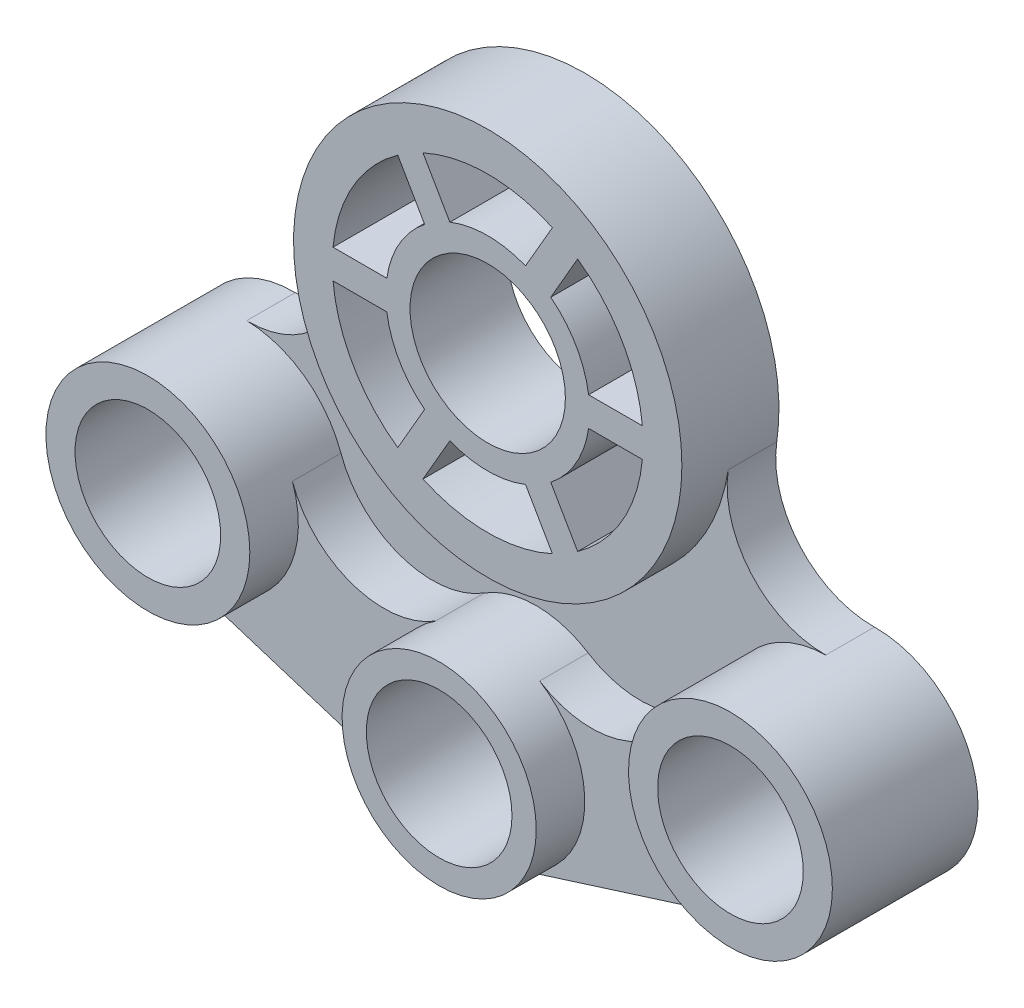
from build123d import *

# Parameters (mm, degrees)
BOSS_EXTRUDE1_DEPTH   = 20
BOSS_EXTRUDE1_2_DEPTH = 20
SKETCH3_R             = 40
SKETCH3_R_2           = 16
BOSS_EXTRUDE1_3_DEPTH = 20
BOSS_EXTRUDE2_DEPTH   = 10
SKETCH3_4_R           = 21
SKETCH3_4_R_2         = 15
SKETCH3_4_R_3         = 20
BOSS_EXTRUDE3_DEPTH   = 30


with BuildPart() as part:
    # Sketch3 → Boss-Extrude1 (new body)
    with BuildSketch(Plane.XY):
        with BuildLine():
            Line((6.023764702, -89.071294105), (66.324952937, -70.02485881))
            ThreePointArc((66.324952937, -70.02485881), (44.876208292, -64.569520389), (40.22513893, -42.932124106))
            ThreePointArc((40.22513893, -42.932124106), (27.903629702, -55.111072059), (10.695968955, -53.100406866))
            ThreePointArc((10.695968955, -53.100406866), (19.833394958, -72.576129737), (6.023764702, -89.071294105))
        make_face()
    extrude(amount=BOSS_EXTRUDE1_DEPTH)



with BuildPart() as body_2:
    # Sketch3 → Boss-Extrude1 2 (new body)
    with BuildSketch(Plane.XY):
        with BuildLine():
            Line((-66.324952937, -70.02485881), (-6.023764702, -89.071294105))
            ThreePointArc((-6.023764702, -89.071294105), (-19.833394958, -72.576129737), (-10.695968955, -53.100406866))
            ThreePointArc((-10.695968955, -53.100406866), (-27.903629702, -55.111072059), (-40.22513893, -42.932124106))
            ThreePointArc((-40.22513893, -42.932124106), (-44.876208292, -64.569520389), (-66.324952937, -70.02485881))
        make_face()
    extrude(amount=BOSS_EXTRUDE1_2_DEPTH)


with BuildPart() as body_3:
    # Sketch3 → Boss-Extrude1 3 (new body)
    with BuildSketch(Plane.XY):
        Circle(SKETCH3_R)
        with BuildLine():
            ThreePointArc((-7.794228634, -19.5), (0, -21), (7.794228634, -19.5))
            Line((7.794228634, -19.5), (13.331456111, -29.090759323))
            ThreePointArc((13.331456111, -29.090759323), (0, -32), (-13.331456111, -29.090759323))
            Line((-13.331456111, -29.090759323), (-7.794228634, -19.5))
        make_face(mode=Mode.SUBTRACT)
        with BuildLine():
            ThreePointArc((-20.784609691, -3), (-18.186533479, -10.5), (-12.990381057, -16.5))
            Line((-12.990381057, -16.5), (-18.527608533, -26.090759323))
            ThreePointArc((-18.527608533, -26.090759323), (-27.712812921, -16), (-31.859064644, -3))
            Line((-31.859064644, -3), (-20.784609691, -3))
        make_face(mode=Mode.SUBTRACT)
        with BuildLine():
            ThreePointArc((-12.990381057, 16.5), (-18.186533479, 10.5), (-20.784609691, 3))
            Line((-20.784609691, 3), (-31.859064644, 3))
            ThreePointArc((-31.859064644, 3), (-27.712812921, 16), (-18.527608533, 26.090759323))
            Line((-18.527608533, 26.090759323), (-12.990381057, 16.5))
        make_face(mode=Mode.SUBTRACT)
        with BuildLine():
            ThreePointArc((7.794228634, 19.5), (0, 21), (-7.794228634, 19.5))
            Line((-7.794228634, 19.5), (-13.331456111, 29.090759323))
            ThreePointArc((-13.331456111, 29.090759323), (0, 32), (13.331456111, 29.090759323))
            Line((13.331456111, 29.090759323), (7.794228634, 19.5))
        make_face(mode=Mode.SUBTRACT)
        with BuildLine():
            ThreePointArc((12.990381057, -16.5), (18.186533479, -10.5), (20.784609691, -3))
            Line((20.784609691, -3), (31.859064644, -3))
            ThreePointArc((31.859064644, -3), (27.712812921, -16), (18.527608533, -26.090759323))
            Line((18.527608533, -26.090759323), (12.990381057, -16.5))
        make_face(mode=Mode.SUBTRACT)
        Circle(SKETCH3_R_2, mode=Mode.SUBTRACT)
        with BuildLine():
            Line((31.859064644, 3), (20.784609691, 3))
            ThreePointArc((20.784609691, 3), (18.186533479, 10.5), (12.990381057, 16.5))
            Line((12.990381057, 16.5), (18.527608533, 26.090759323))
            ThreePointArc((18.527608533, 26.090759323), (27.712812921, 16), (31.859064644, 3))
        make_face(mode=Mode.SUBTRACT)
    extrude(amount=BOSS_EXTRUDE1_3_DEPTH)


with BuildPart() as part_1:
    add(part.part)

    add(body_2.part)  # Boss-Extrude2 merges body 2

    add(body_3.part)  # Boss-Extrude2 merges body 3
    # Sketch3<3> → Boss-Extrude2 (add)
    with BuildSketch(Plane.XY):
        with BuildLine():
            ThreePointArc((10.695968955, -53.100406866), (27.903629702, -55.111072059), (40.22513893, -42.932124106))
            ThreePointArc((40.22513893, -42.932124106), (47.76318349, -32.933649432), (59.651863383, -29.002885891))
            ThreePointArc((59.651863383, -29.002885891), (44.262528341, -22.168588856), (39.546869801, -6.003756239))
            ThreePointArc((39.546869801, -6.003756239), (0, -40), (-39.546869801, -6.003756239))
            ThreePointArc((-39.546869801, -6.003756239), (-44.262528341, -22.168588856), (-59.651863383, -29.002885891))
            ThreePointArc((-59.651863383, -29.002885891), (-47.76318349, -32.933649432), (-40.22513893, -42.932124106))
            ThreePointArc((-40.22513893, -42.932124106), (-27.903629702, -55.111072059), (-10.695968955, -53.100406866))
            ThreePointArc((-10.695968955, -53.100406866), (0, -50), (10.695968955, -53.100406866))
        make_face()
    extrude(amount=BOSS_EXTRUDE2_DEPTH)

    # Sketch3<4> → Boss-Extrude3 (add)
    # profile 1 of 3: a face of its own
    with BuildSketch(Plane.XY):
        with Locations((60, -50)):
            Circle(SKETCH3_4_R)
        with Locations((60, -50)):
            Circle(SKETCH3_4_R_2, mode=Mode.SUBTRACT)
    # profile 2 of 3: a face of its own
    with BuildSketch(Plane.XY):
        with Locations((0, -70)):
            Circle(SKETCH3_4_R_3)
        with Locations((0, -70)):
            Circle(SKETCH3_4_R_2, mode=Mode.SUBTRACT)
    # profile 3 of 3: a face of its own
    with BuildSketch(Plane.XY):
        with Locations((-60, -50)):
            Circle(SKETCH3_4_R)
        with Locations((-60, -50)):
            Circle(SKETCH3_4_R_2, mode=Mode.SUBTRACT)
    extrude(amount=BOSS_EXTRUDE3_DEPTH)


solid = part_1.part
